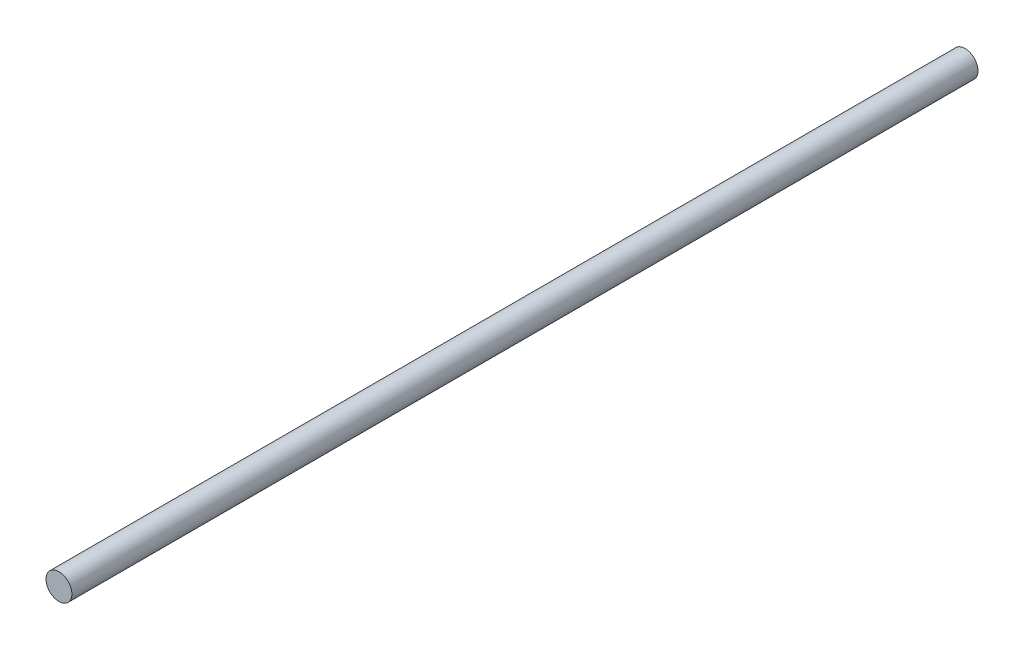
from build123d import *

# Parameters (mm, degrees)
SKETCH1_R           = 10
BOSS_EXTRUDE1_DEPTH = 700


with BuildPart() as part:
    # Sketch1 → Boss-Extrude1 (new body)
    with BuildSketch(Plane.XY):
        Circle(SKETCH1_R)
    extrude(amount=BOSS_EXTRUDE1_DEPTH)


solid = part.part
